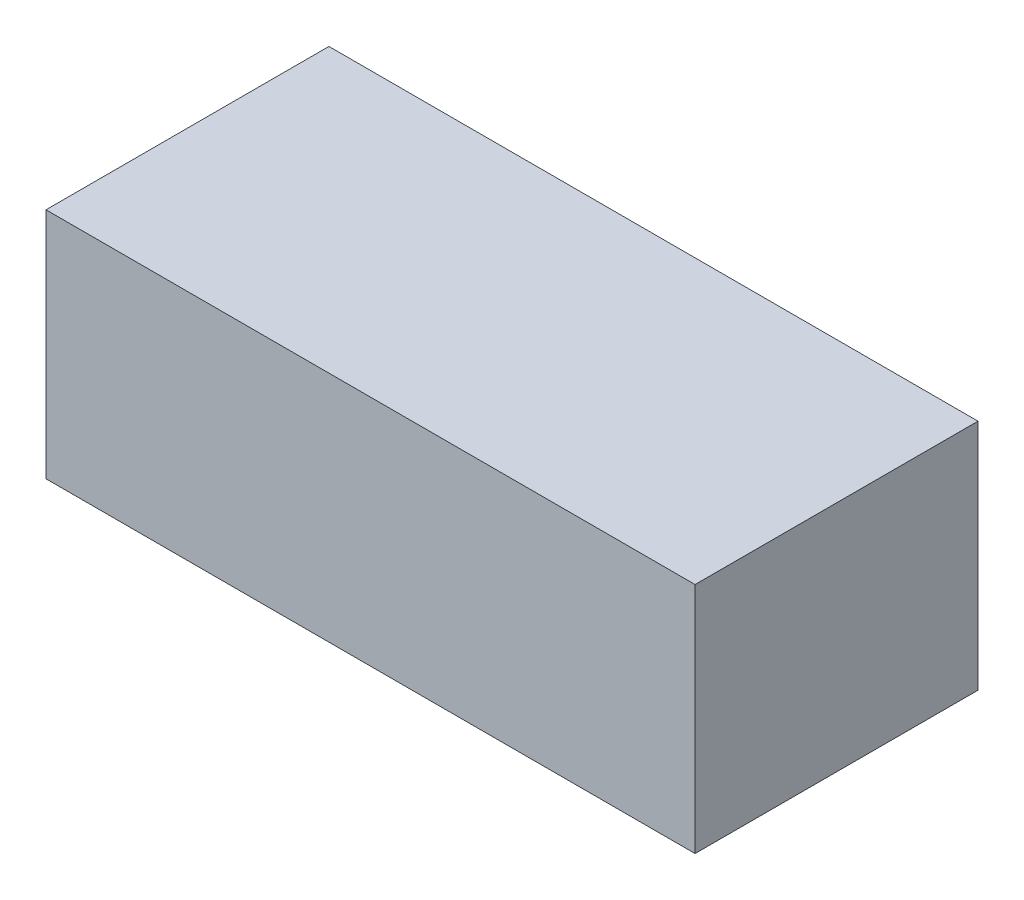
from build123d import *

# Parameters (mm, degrees)
SKETCH1_W           = 78
SKETCH1_H           = 34
BOSS_EXTRUDE1_DEPTH = 28


with BuildPart() as part:
    # Sketch1 → Boss-Extrude1 (new body)
    with BuildSketch(Plane(origin=(0, 0, 0), x_dir=(1, 0, 0), z_dir=(0, 1, 0))):
        Rectangle(SKETCH1_W, SKETCH1_H)
    extrude(amount=BOSS_EXTRUDE1_DEPTH)


solid = part.part
